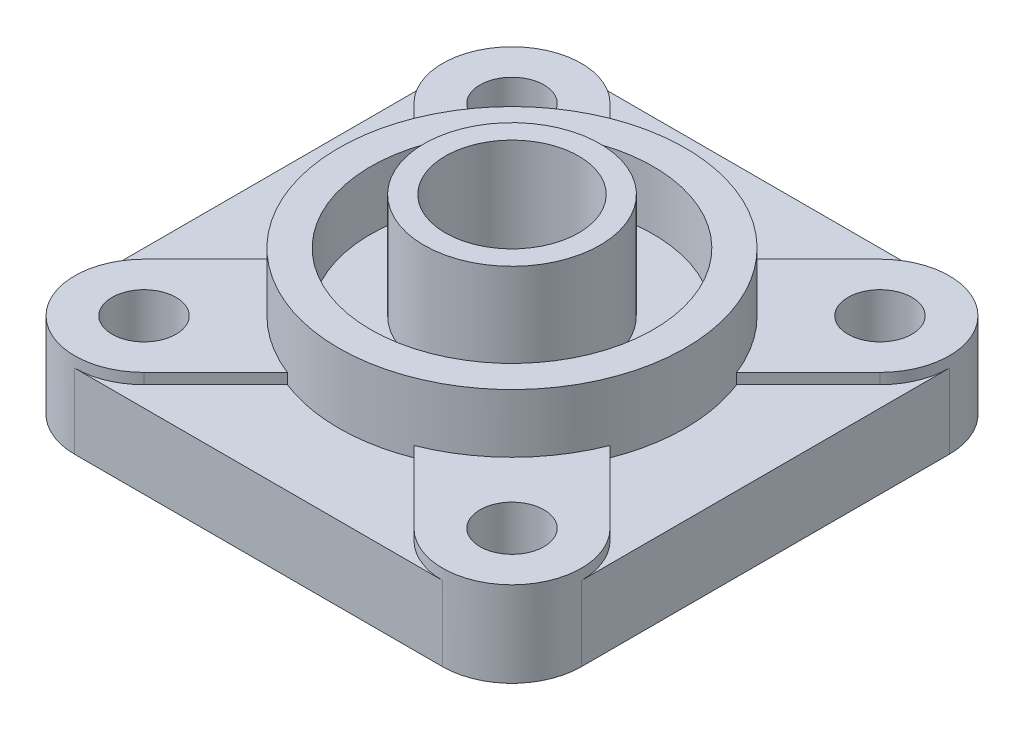
from build123d import *

# Parameters (mm, degrees)
SKETCH1_W           = 95
SKETCH1_H           = 95
BOSS_EXTRUDE1_DEPTH = 14
BOSS_EXTRUDE2_DEPTH = 16
SKETCH4_R           = 32.5
BOSS_EXTRUDE3_DEPTH = 13
SKETCH5_R           = 12.5
CUT_EXTRUDE1_DEPTH  = 73.398204398
SKETCH6_R           = 26.5
SKETCH6_R_2         = 16.5
CUT_EXTRUDE2_DEPTH  = 11
BOSS_EXTRUDE4_START = 35.7
SKETCH7_R           = 16.5
SKETCH7_R_2         = 12.5
BOSS_EXTRUDE4_DEPTH = 35.7
CUT_EXTRUDE3_DEPTH  = 77.072268272
SKETCH9_R           = 6
CUT_EXTRUDE5_DEPTH  = 77.072268272


with BuildPart() as part:
    # Sketch1 → Boss-Extrude1 (new body)
    with BuildSketch(Plane(origin=(0, 0, 0), x_dir=(1, 0, 0), z_dir=(0, 1, 0))):
        Rectangle(SKETCH1_W, SKETCH1_H)
    extrude(amount=BOSS_EXTRUDE1_DEPTH)

    # Sketch2 → Boss-Extrude2 (add)
    with BuildSketch(Plane(origin=(0, 0, 0), x_dir=(1, 0, 0), z_dir=(0, 1, 0))):
        with BuildLine():
            Line((-30.254795425, 11.870019114), (-43.692388155, 25.307611845))
            ThreePointArc((-43.692388155, 25.307611845), (-43.692388155, 43.692388155), (-25.307611845, 43.692388155))
            Line((-25.307611845, 43.692388155), (-11.870019114, 30.254795425))
            ThreePointArc((-11.870019114, 30.254795425), (-22.980970389, 22.980970389), (-30.254795425, 11.870019114))
        make_face()
        with BuildLine():
            Line((11.870019114, 30.254795425), (25.307611845, 43.692388155))
            ThreePointArc((25.307611845, 43.692388155), (43.692388155, 43.692388155), (43.692388155, 25.307611845))
            Line((43.692388155, 25.307611845), (30.254795425, 11.870019114))
            ThreePointArc((30.254795425, 11.870019114), (22.980970389, 22.980970389), (11.870019114, 30.254795425))
        make_face()
        with BuildLine():
            Line((30.254795425, -11.870019114), (43.692388155, -25.307611845))
            ThreePointArc((43.692388155, -25.307611845), (43.692388155, -43.692388155), (25.307611845, -43.692388155))
            Line((25.307611845, -43.692388155), (11.870019114, -30.254795425))
            ThreePointArc((11.870019114, -30.254795425), (22.980970389, -22.980970389), (30.254795425, -11.870019114))
        make_face()
        with BuildLine():
            Line((-11.870019114, -30.254795425), (-25.307611845, -43.692388155))
            ThreePointArc((-25.307611845, -43.692388155), (-43.692388155, -43.692388155), (-43.692388155, -25.307611845))
            Line((-43.692388155, -25.307611845), (-30.254795425, -11.870019114))
            ThreePointArc((-30.254795425, -11.870019114), (-22.980970389, -22.980970389), (-11.870019114, -30.254795425))
        make_face()
    extrude(amount=BOSS_EXTRUDE2_DEPTH)

    # Sketch4 → Boss-Extrude3 (add)
    with BuildSketch(Plane(origin=(0, 14, 0), x_dir=(1, 0, 0), z_dir=(0, 1, 0))):
        with Locations(Location((0, 0, 0), (0, 0, 111.421821522))):
            Circle(SKETCH4_R)
    extrude(amount=BOSS_EXTRUDE3_DEPTH)

    # Sketch5 → Cut-Extrude1 (cut, through all)
    with BuildSketch(Plane(origin=(0, 27, 0), x_dir=(1, 0, 0), z_dir=(0, 1, 0))):
        with Locations(Location((0, 0, 0), (0, 0, 270))):
            Circle(SKETCH5_R)
    extrude(amount=-CUT_EXTRUDE1_DEPTH, mode=Mode.SUBTRACT)

    # Sketch6 → Cut-Extrude2 (cut)
    with BuildSketch(Plane(origin=(0, 27, 0), x_dir=(1, 0, 0), z_dir=(0, 1, 0))):
        with Locations(Location((0, 0, 0), (0, 0, 270))):
            Circle(SKETCH6_R)
        with Locations(Location((0, 0, 0), (0, 0, 270))):
            Circle(SKETCH6_R_2, mode=Mode.SUBTRACT)
    extrude(amount=-CUT_EXTRUDE2_DEPTH, mode=Mode.SUBTRACT)

    # Sketch7 → Boss-Extrude4 (add)
    with BuildSketch(Plane(origin=(0, 0, 0), x_dir=(1, 0, 0), z_dir=(0, 1, 0)).offset(BOSS_EXTRUDE4_START)):
        with Locations(Location((0, 0, 0), (0, 0, 270))):
            Circle(SKETCH7_R)
        with Locations(Location((0, 0, 0), (0, 0, 270))):
            Circle(SKETCH7_R_2, mode=Mode.SUBTRACT)
    extrude(amount=-BOSS_EXTRUDE4_DEPTH)

    # Sketch8 → Cut-Extrude3 (cut, through all)
    with BuildSketch(Plane(origin=(0, 0, 0), x_dir=(1, 0, 0), z_dir=(0, 1, 0))):
        with BuildLine():
            Line((-47.5, -34.5), (-47.5, -47.5))
            Line((-47.5, -47.5), (-34.5, -47.5))
            ThreePointArc((-34.5, -47.5), (-43.692388155, -43.692388155), (-47.5, -34.5))
        make_face()
        with BuildLine():
            Line((-34.5, 47.5), (-47.5, 47.5))
            Line((-47.5, 47.5), (-47.5, 34.5))
            ThreePointArc((-47.5, 34.5), (-43.692388155, 43.692388155), (-34.5, 47.5))
        make_face()
        with BuildLine():
            Line((47.5, 34.5), (47.5, 47.5))
            Line((47.5, 47.5), (34.5, 47.5))
            ThreePointArc((34.5, 47.5), (43.692388155, 43.692388155), (47.5, 34.5))
        make_face()
        with BuildLine():
            Line((34.5, -47.5), (47.5, -47.5))
            Line((47.5, -47.5), (47.5, -34.5))
            ThreePointArc((47.5, -34.5), (43.692388155, -43.692388155), (34.5, -47.5))
        make_face()
    extrude(amount=CUT_EXTRUDE3_DEPTH, mode=Mode.SUBTRACT)

    # Sketch9 → Cut-Extrude5 (cut, through all)
    with BuildSketch(Plane(origin=(0, 0, 0), x_dir=(1, 0, 0), z_dir=(0, 1, 0))):
        with Locations(Location((-34.5, 34.5, 0), (0, 0, 90))):
            Circle(SKETCH9_R)
        with Locations(Location((34.5, 34.5, 0), (0, 0, 90))):
            Circle(SKETCH9_R)
        with Locations(Location((34.5, -34.5, 0), (0, 0, 90))):
            Circle(SKETCH9_R)
        with Locations(Location((-34.5, -34.5, 0), (0, 0, 90))):
            Circle(SKETCH9_R)
    extrude(amount=CUT_EXTRUDE5_DEPTH, mode=Mode.SUBTRACT)


solid = part.part
